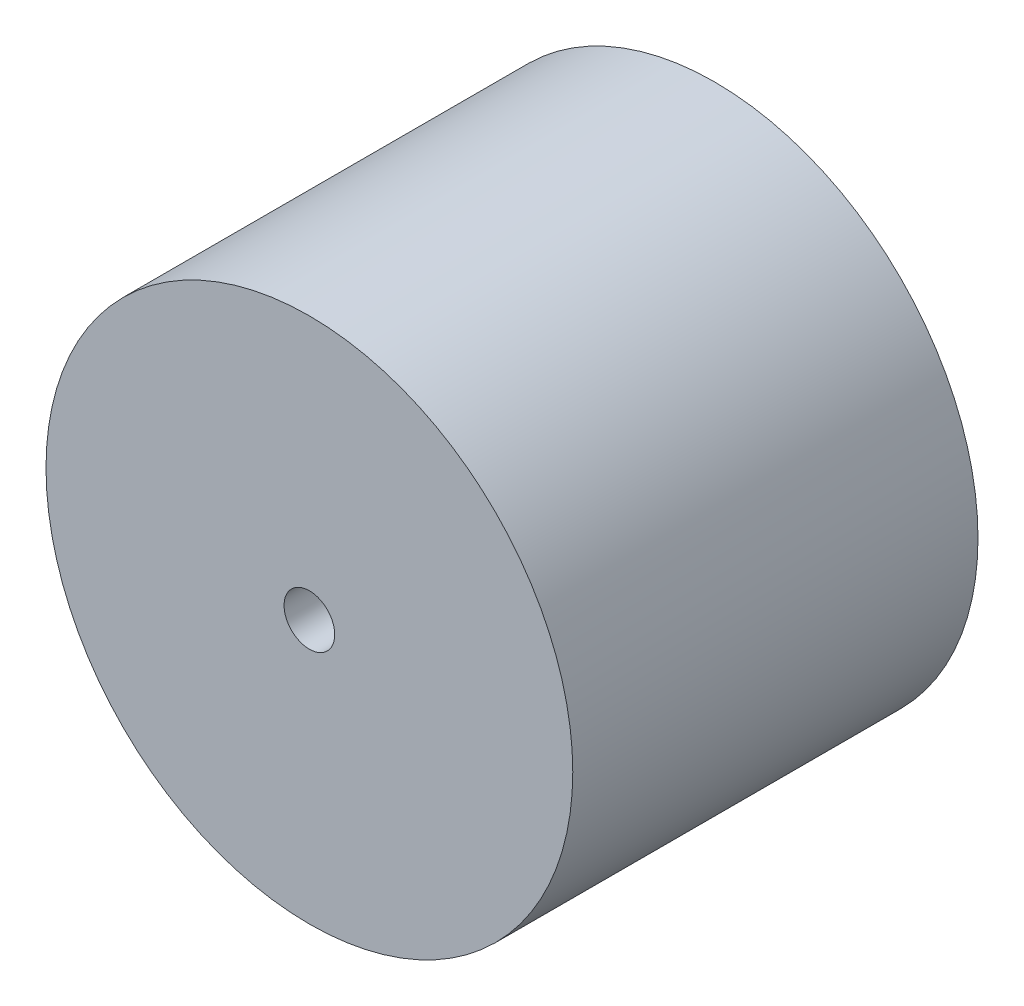
from build123d import *

# Parameters (mm, degrees)
SKETCH2_R           = 16.51
BOSS_EXTRUDE1_DEPTH = 25.4
SKETCH3_R           = 1.5875
CUT_EXTRUDE1_DEPTH  = 35.501017376


with BuildPart() as part:
    # Sketch2 → Boss-Extrude1 (new body)
    with BuildSketch(Plane.XY):
        Circle(SKETCH2_R)
    extrude(amount=BOSS_EXTRUDE1_DEPTH)

    # Sketch3 → Cut-Extrude1 (cut, through all)
    with BuildSketch(Plane.XY.offset(25.4)):
        Circle(SKETCH3_R)
    extrude(amount=-CUT_EXTRUDE1_DEPTH, mode=Mode.SUBTRACT)


solid = part.part
